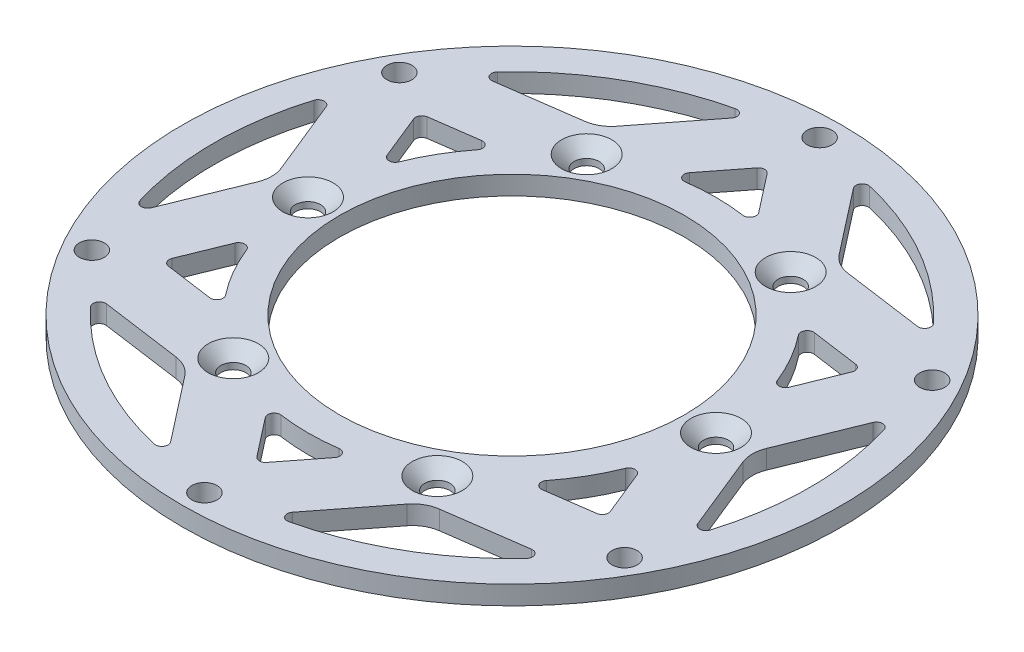
from build123d import *

# Parameters (mm, degrees)
SKETCH_1_R               = 52.5
SKETCH_1_R_2             = 2
SKETCH_1_R_3             = 27.5
EXTRUDE_1_DEPTH          = 3
HOLE_WIZARD_1_AT_2_COUNT = 2
HOLE_WIZARD_1_AT_2_PITCH = 32.5
HOLE_WIZARD_1_AT_3_COUNT = 2
HOLE_WIZARD_1_AT_3_PITCH = 56.291651246
HOLE_WIZARD_1_AT_4_COUNT = 2
HOLE_WIZARD_1_AT_4_PITCH = 65
HOLE_WIZARD_1_AT_5_COUNT = 2
HOLE_WIZARD_1_AT_5_PITCH = 56.291651246
HOLE_WIZARD_1_AT_6_COUNT = 2
HOLE_WIZARD_1_AT_6_PITCH = 32.5
CUT_EXTRUDE_1_DEPTH      = 10
FILLET_1_R               = 5
FILLET_2_R               = 1


with BuildPart() as part:
    # 草图1 → 凸台-拉伸1 (new body)
    with BuildSketch(Plane(origin=(0, 0, 0), x_dir=(1, 0, 0), z_dir=(0, 1, 0))):
        with Locations(Location((0, 0, 0), (0, 0, 270))):
            Circle(SKETCH_1_R)
        with Locations(Location((0, 49, 0), (0, 0, 270))):
            Circle(SKETCH_1_R_2, mode=Mode.SUBTRACT)
        with Locations(Location((-16.25, 28.145825623, 0), (0, 0, 270))):
            Circle(SKETCH_1_R_2, mode=Mode.SUBTRACT)
        with Locations(Location((42.435244785, 24.5, 0), (0, 0, 270))):
            Circle(SKETCH_1_R_2, mode=Mode.SUBTRACT)
        with Locations(Location((16.25, 28.145825623, 0), (0, 0, 270))):
            Circle(SKETCH_1_R_2, mode=Mode.SUBTRACT)
        with Locations(Location((42.435244785, -24.5, 0), (0, 0, 270))):
            Circle(SKETCH_1_R_2, mode=Mode.SUBTRACT)
        with Locations(Location((32.5, 0, 0), (0, 0, 270))):
            Circle(SKETCH_1_R_2, mode=Mode.SUBTRACT)
        with Locations(Location((0, -49, 0), (0, 0, 270))):
            Circle(SKETCH_1_R_2, mode=Mode.SUBTRACT)
        with Locations(Location((16.25, -28.145825623, 0), (0, 0, 270))):
            Circle(SKETCH_1_R_2, mode=Mode.SUBTRACT)
        with Locations(Location((-42.435244785, -24.5, 0), (0, 0, 270))):
            Circle(SKETCH_1_R_2, mode=Mode.SUBTRACT)
        with Locations(Location((-16.25, -28.145825623, 0), (0, 0, 270))):
            Circle(SKETCH_1_R_2, mode=Mode.SUBTRACT)
        with Locations(Location((-42.435244785, 24.5, 0), (0, 0, 270))):
            Circle(SKETCH_1_R_2, mode=Mode.SUBTRACT)
        with Locations(Location((-32.5, 0, 0), (0, 0, 270))):
            Circle(SKETCH_1_R_2, mode=Mode.SUBTRACT)
        with Locations(Location((0, 0, 0), (0, 0, 270))):
            Circle(SKETCH_1_R_3, mode=Mode.SUBTRACT)
    extrude(amount=EXTRUDE_1_DEPTH)

    # 草图3 → 孔1 (revolve, cut)
    with BuildSketch(Plane(origin=(-16.25, 3, -28.145825623), x_dir=(0, 0, 1), z_dir=(1, 0, 0))):
        Polygon((0, 0), (0, 3), (2, 3), (2, 2), (4, 0), align=None)
    hole_wizard_1 = revolve(axis=Axis((-16.25, 9.445314094, -28.145825623), (0, -1, 0)), mode=Mode.SUBTRACT)

    # 孔1 at 2: 孔1 ×2
    with Locations(*[(i * HOLE_WIZARD_1_AT_2_PITCH, 0, 0) for i in range(1, HOLE_WIZARD_1_AT_2_COUNT)]):
        add(hole_wizard_1, mode=Mode.SUBTRACT)

    # 孔1 at 3: 孔1 ×2
    with Locations(*[Vector(0.8660254037844387, 0, 0.5) * (i * HOLE_WIZARD_1_AT_3_PITCH) for i in range(1, HOLE_WIZARD_1_AT_3_COUNT)]):
        add(hole_wizard_1, mode=Mode.SUBTRACT)

    # 孔1 at 4: 孔1 ×2
    with Locations(*[Vector(0.5000000000000001, 0, 0.8660254037844386) * (i * HOLE_WIZARD_1_AT_4_PITCH) for i in range(1, HOLE_WIZARD_1_AT_4_COUNT)]):
        add(hole_wizard_1, mode=Mode.SUBTRACT)

    # 孔1 at 5: 孔1 ×2
    with Locations(*[(0, 0, i * HOLE_WIZARD_1_AT_5_PITCH) for i in range(1, HOLE_WIZARD_1_AT_5_COUNT)]):
        add(hole_wizard_1, mode=Mode.SUBTRACT)

    # 孔1 at 6: 孔1 ×2
    with Locations(*[Vector(-0.5000000000000003, 0, 0.8660254037844386) * (i * HOLE_WIZARD_1_AT_6_PITCH) for i in range(1, HOLE_WIZARD_1_AT_6_COUNT)]):
        add(hole_wizard_1, mode=Mode.SUBTRACT)

    # 草图5 → 切除-拉伸1 (cut)
    with BuildSketch(Plane(origin=(0, 3, 0), x_dir=(1, 0, 0), z_dir=(0, 1, 0))):
        with BuildLine():
            Line((-8.041886602, 46.814293329), (-18.947738206, 32.818445262))
            Line((-18.947738206, 32.818445262), (-36.521423982, 30.371624756))
            ThreePointArc((-36.521423982, 30.371624756), (-23.75, 41.13620668), (-8.041886602, 46.814293329))
        make_face()
        with BuildLine():
            Line((0, 40.865281716), (7.136483547, 31.706791111))
            ThreePointArc((7.136483547, 31.706791111), (0, 32.5), (-7.136483547, 31.706791111))
            Line((-7.136483547, 31.706791111), (0, 40.865281716))
        make_face()
        with BuildLine():
            Line((18.947738206, 32.818445262), (8.041886602, 46.814293329))
            ThreePointArc((8.041886602, 46.814293329), (23.75, 41.13620668), (36.521423982, 30.371624756))
            Line((36.521423982, 30.371624756), (18.947738206, 32.818445262))
        make_face()
        with BuildLine():
            Line((35.390372099, 20.432640858), (23.890644801, 22.033771601))
            ThreePointArc((23.890644801, 22.033771601), (28.145825623, 16.25), (31.027128348, 9.67301951))
            Line((31.027128348, 9.67301951), (35.390372099, 20.432640858))
        make_face()
        with BuildLine():
            Line((37.895476413, 0), (44.563310584, 16.442668573))
            ThreePointArc((44.563310584, 16.442668573), (47.5, 0), (44.563310584, -16.442668573))
            Line((44.563310584, -16.442668573), (37.895476413, 0))
        make_face()
        with BuildLine():
            Line((35.390372099, -20.432640858), (31.027128348, -9.67301951))
            ThreePointArc((31.027128348, -9.67301951), (28.145825623, -16.25), (23.890644801, -22.033771601))
            Line((23.890644801, -22.033771601), (35.390372099, -20.432640858))
        make_face()
        with BuildLine():
            Line((18.947738206, -32.818445262), (36.521423982, -30.371624756))
            ThreePointArc((36.521423982, -30.371624756), (23.75, -41.13620668), (8.041886602, -46.814293329))
            Line((8.041886602, -46.814293329), (18.947738206, -32.818445262))
        make_face()
        with BuildLine():
            Line((0, -40.865281716), (7.136483547, -31.706791111))
            ThreePointArc((7.136483547, -31.706791111), (0, -32.5), (-7.136483547, -31.706791111))
            Line((-7.136483547, -31.706791111), (0, -40.865281716))
        make_face()
        with BuildLine():
            Line((-18.947738206, -32.818445262), (-8.041886602, -46.814293329))
            ThreePointArc((-8.041886602, -46.814293329), (-23.75, -41.13620668), (-36.521423982, -30.371624756))
            Line((-36.521423982, -30.371624756), (-18.947738206, -32.818445262))
        make_face()
        with BuildLine():
            Line((-35.390372099, -20.432640858), (-23.890644801, -22.033771601))
            ThreePointArc((-23.890644801, -22.033771601), (-28.145825623, -16.25), (-31.027128348, -9.67301951))
            Line((-31.027128348, -9.67301951), (-35.390372099, -20.432640858))
        make_face()
        with BuildLine():
            Line((-37.895476413, 0), (-44.563310584, -16.442668573))
            ThreePointArc((-44.563310584, -16.442668573), (-47.5, 0), (-44.563310584, 16.442668573))
            Line((-44.563310584, 16.442668573), (-37.895476413, 0))
        make_face()
        with BuildLine():
            Line((-35.390372099, 20.432640858), (-31.027128348, 9.67301951))
            ThreePointArc((-31.027128348, 9.67301951), (-28.145825623, 16.25), (-23.890644801, 22.033771601))
            Line((-23.890644801, 22.033771601), (-35.390372099, 20.432640858))
        make_face()
    extrude(amount=-CUT_EXTRUDE_1_DEPTH, mode=Mode.SUBTRACT)

    # 圆角1
    fillet_1_edges = [part.edges().sort_by_distance(p)[0] for p in [
        (-18.947738206, 1.5, 32.818445262),
        (18.947738206, 1.5, 32.818445262),
        (37.895476413, 1.5, 0),
        (18.947738206, 1.5, -32.818445262),
        (-37.895476413, 1.5, 0),
        (-18.947738206, 1.5, -32.818445262),
    ]]
    fillet(fillet_1_edges, radius=FILLET_1_R)

    # 圆角2
    fillet_2_edges = [part.edges().sort_by_distance(p)[0] for p in [
        (-8.041886602, 1.5, 46.814293329),
        (-36.521423982, 1.5, 30.371624756),
        (0, 1.5, 40.865281716),
        (-7.136483547, 1.5, 31.706791111),
        (7.136483547, 1.5, 31.706791111),
        (36.521423982, 1.5, 30.371624756),
        (8.041886602, 1.5, 46.814293329),
        (35.390372099, 1.5, 20.432640858),
        (23.890644801, 1.5, 22.033771601),
        (31.027128348, 1.5, 9.67301951),
        (44.563310584, 1.5, -16.442668573),
        (44.563310584, 1.5, 16.442668573),
        (35.390372099, 1.5, -20.432640858),
        (31.027128348, 1.5, -9.67301951),
        (23.890644801, 1.5, -22.033771601),
        (8.041886602, 1.5, -46.814293329),
        (36.521423982, 1.5, -30.371624756),
        (-7.136483547, 1.5, -31.706791111),
        (0, 1.5, -40.865281716),
        (7.136483547, 1.5, -31.706791111),
        (-35.390372099, 1.5, -20.432640858),
        (-23.890644801, 1.5, -22.033771601),
        (-31.027128348, 1.5, -9.67301951),
        (-44.563310584, 1.5, 16.442668573),
        (-44.563310584, 1.5, -16.442668573),
        (-35.390372099, 1.5, 20.432640858),
        (-31.027128348, 1.5, 9.67301951),
        (-23.890644801, 1.5, 22.033771601),
        (-36.521423982, 1.5, -30.371624756),
        (-8.041886602, 1.5, -46.814293329),
    ]]
    fillet(fillet_2_edges, radius=FILLET_2_R)


solid = part.part
